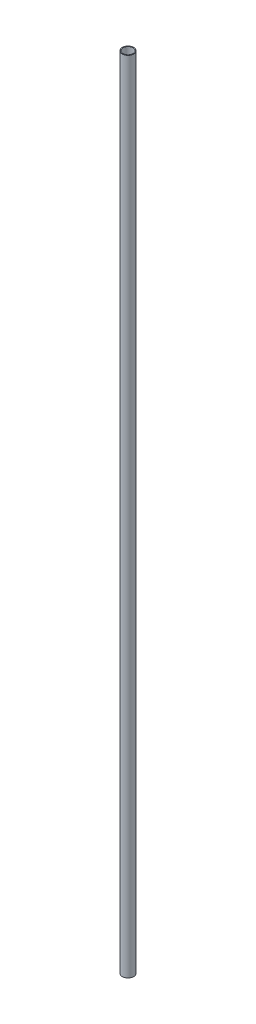
from build123d import *

# Parameters (mm, degrees)
SKETCH1_R           = 9.525
SKETCH1_R_2         = 8.2804
BOSS_EXTRUDE1_DEPTH = 1320.8


with BuildPart() as part:
    # Sketch1 → Boss-Extrude1 (new body)
    with BuildSketch(Plane(origin=(0, 0, 0), x_dir=(1, 0, 0), z_dir=(0, 1, 0))):
        with Locations(Location((0, 0, 0), (0, 0, 270))):
            Circle(SKETCH1_R)
        with Locations(Location((0, 0, 0), (0, 0, 270))):
            Circle(SKETCH1_R_2, mode=Mode.SUBTRACT)
    extrude(amount=BOSS_EXTRUDE1_DEPTH)


solid = part.part
